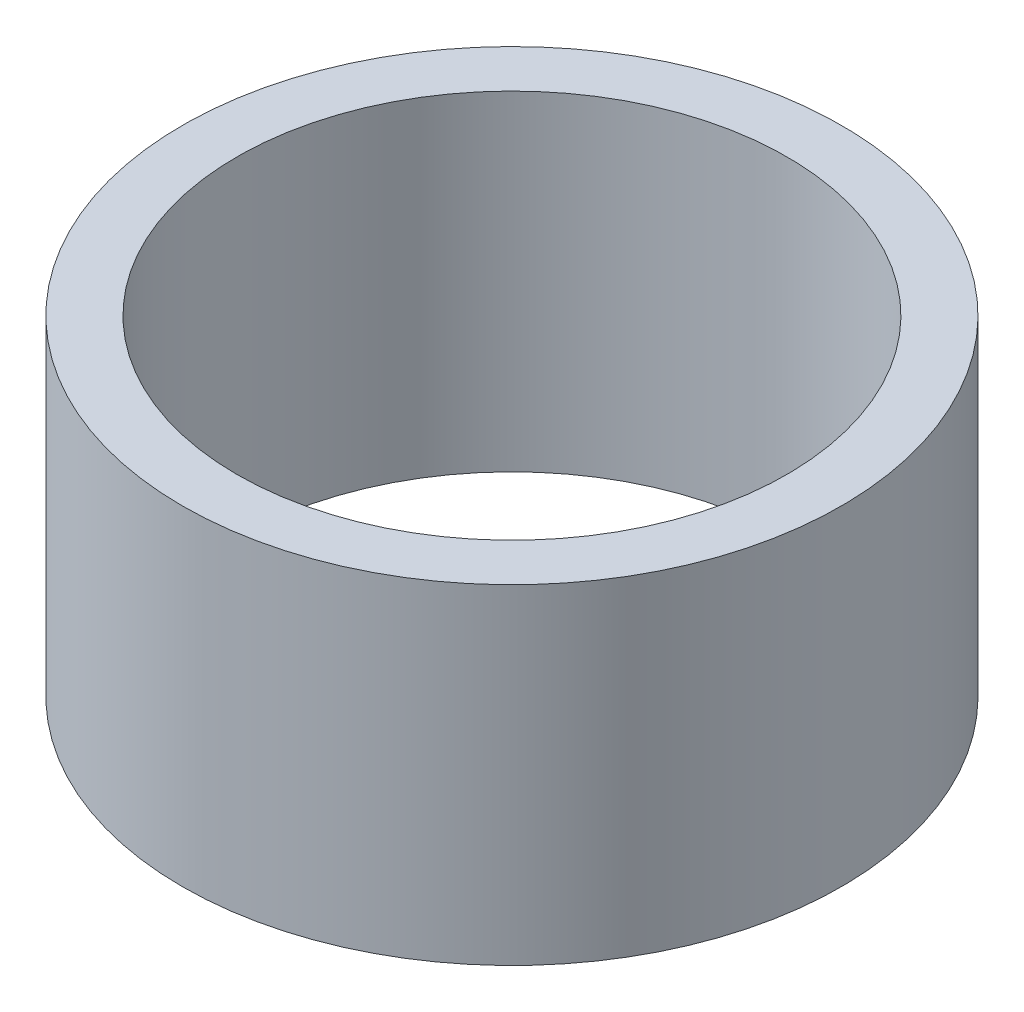
from build123d import *

# Parameters (mm, degrees)
SKETCH1_R           = 152.307886398
BOSS_EXTRUDE1_DEPTH = 152.4
SKETCH2_R           = 127.120647114
CUT_EXTRUDE1_DEPTH  = 152.4


with BuildPart() as part:
    # Sketch1 → Boss-Extrude1 (new body)
    with BuildSketch(Plane(origin=(0, 0, 0), x_dir=(1, 0, 0), z_dir=(0, 1, 0))):
        with Locations(Location((0, 0, 0), (0, 0, 270))):
            Circle(SKETCH1_R)
    extrude(amount=BOSS_EXTRUDE1_DEPTH)

    # Sketch2 → Cut-Extrude1 (cut)
    with BuildSketch(Plane(origin=(0, 152.4, 0), x_dir=(1, 0, 0), z_dir=(0, 1, 0))):
        with Locations(Location((0, 0, 0), (0, 0, 270))):
            Circle(SKETCH2_R)
    extrude(amount=-CUT_EXTRUDE1_DEPTH, mode=Mode.SUBTRACT)


solid = part.part
